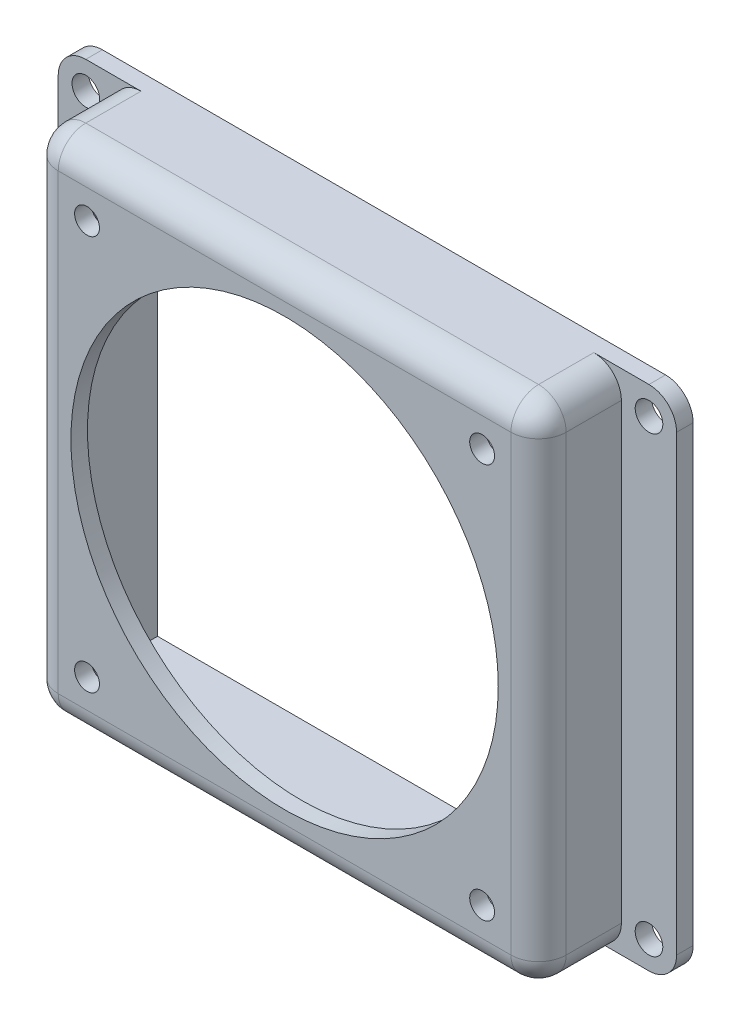
from build123d import *

# Parameters (mm, degrees)
SKETCH1_W           = 92
SKETCH1_H           = 92
SKETCH1_R           = 38.7
SKETCH1_R_2         = 2.25
BOSS_EXTRUDE1_DEPTH = 3
SKETCH2_W           = 92
SKETCH2_H           = 92
SKETCH2_W_2         = 82
SKETCH2_H_2         = 82
BOSS_EXTRUDE2_DEPTH = 15
SKETCH3_W           = 10
SKETCH3_H           = 92
SKETCH3_R           = 2.5
BOSS_EXTRUDE3_DEPTH = 3
FILLET1_R           = 5


with BuildPart() as part:
    # Sketch1 → Boss-Extrude1 (new body)
    with BuildSketch(Plane.XY):
        Rectangle(SKETCH1_W, SKETCH1_H)
        Circle(SKETCH1_R, mode=Mode.SUBTRACT)
        with Locations((-35.78, 35.78)):
            Circle(SKETCH1_R_2, mode=Mode.SUBTRACT)
        with Locations((35.78, 35.78)):
            Circle(SKETCH1_R_2, mode=Mode.SUBTRACT)
        with Locations((35.78, -35.78)):
            Circle(SKETCH1_R_2, mode=Mode.SUBTRACT)
        with Locations((-35.78, -35.78)):
            Circle(SKETCH1_R_2, mode=Mode.SUBTRACT)
    extrude(amount=BOSS_EXTRUDE1_DEPTH)

    # Sketch2 → Boss-Extrude2 (add)
    with BuildSketch(Plane(origin=(0, 0, 0), x_dir=(-1, 0, 0), z_dir=(0, 0, -1))):
        Rectangle(SKETCH2_W, SKETCH2_H)
        Rectangle(SKETCH2_W_2, SKETCH2_H_2, mode=Mode.SUBTRACT)
    extrude(amount=BOSS_EXTRUDE2_DEPTH)

    # Sketch3 → Boss-Extrude3 (add)
    # profile 1 of 2: a face of its own
    with BuildSketch(Plane(origin=(0, 0, -15), x_dir=(-1, 0, 0), z_dir=(0, 0, -1))):
        with Locations((-51, 0)):
            Rectangle(SKETCH3_W, SKETCH3_H)
        with Locations((-51, 41)):
            Circle(SKETCH3_R, mode=Mode.SUBTRACT)
        with Locations((-51, -41)):
            Circle(SKETCH3_R, mode=Mode.SUBTRACT)
    # profile 2 of 2: a face of its own
    with BuildSketch(Plane(origin=(0, 0, -15), x_dir=(-1, 0, 0), z_dir=(0, 0, -1))):
        with Locations((51, 0)):
            Rectangle(SKETCH3_W, SKETCH3_H)
        with Locations((51, 41)):
            Circle(SKETCH3_R, mode=Mode.SUBTRACT)
        with Locations((51, -41)):
            Circle(SKETCH3_R, mode=Mode.SUBTRACT)
    extrude(amount=-BOSS_EXTRUDE3_DEPTH)

    # Fillet1
    fillet1_edges = [part.edges().sort_by_distance(p)[0] for p in [
        (46, 0, 3),
        (0, 46, 3),
        (-46, 0, 3),
        (56, -46, -13.5),
        (56, 46, -13.5),
        (-56, 46, -13.5),
        (-56, -46, -13.5),
        (-46, 46, -4.5),
        (46, 46, -4.5),
        (46, -46, -4.5),
        (-46, -46, -4.5),
        (0, -46, 3),
    ]]
    fillet(fillet1_edges, radius=FILLET1_R)


solid = part.part
